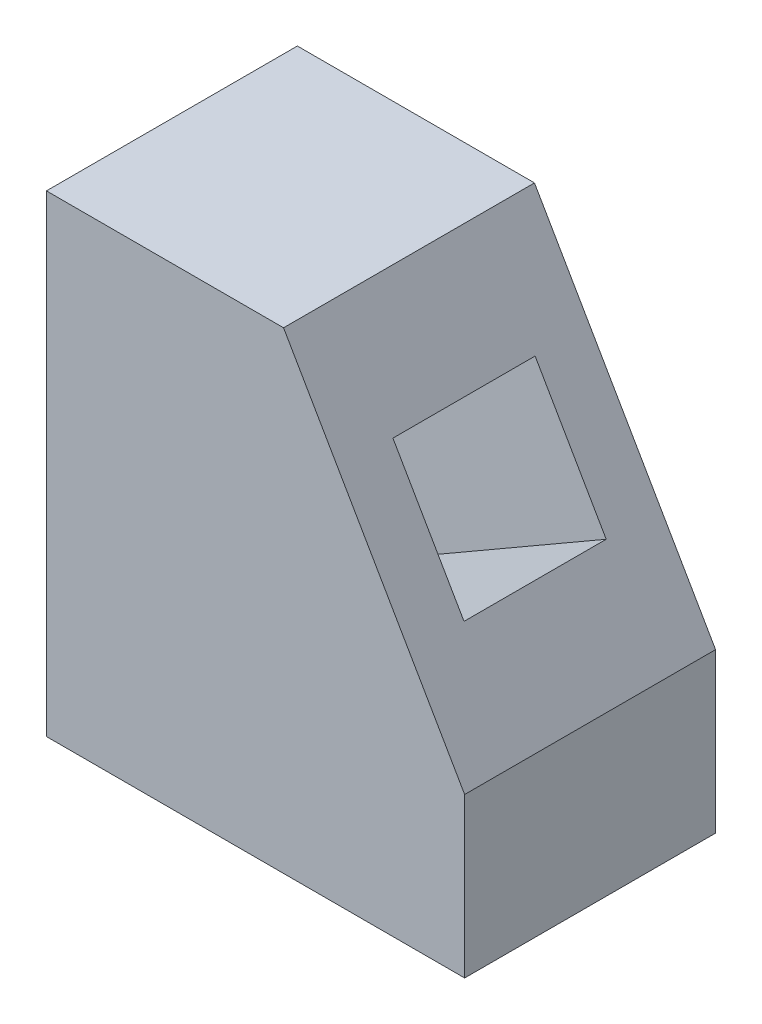
from build123d import *

# Parameters (mm, degrees)
SKETCH_1_W          = 10
SKETCH_1_H          = 6
EXTRUDE_1_DEPTH     = 11.3
CUT_EXTRUDE_1_REACH = 18.239
SKETCH_3_W          = 3.4
SKETCH_3_H          = 3.4
CUT_EXTRUDE_2_DEPTH = 8
SKETCH_4_R          = 0.5
CUT_EXTRUDE_3_DEPTH = 0.1


with BuildPart() as part:
    # 草图1 → 凸台-拉伸1 (new body)
    with BuildSketch(Plane(origin=(0, 0, 0), x_dir=(1, 0, 0), z_dir=(0, 1, 0))):
        with Locations((5, 3)):
            Rectangle(SKETCH_1_W, SKETCH_1_H)
    extrude(amount=EXTRUDE_1_DEPTH)

    # 草图2 → 切除-拉伸1 (cut, up to next)
    with BuildSketch(Plane(origin=(0, 0, -6), x_dir=(-1, 0, 0), z_dir=(0, 0, -1)), mode=Mode.PRIVATE) as cut_extrude_1_sk1:
        Polygon((-10, 3.8), (-5.669872981, 11.3), (-10, 11.3), align=None)
    cut_extrude_1_tool1 = extrude(cut_extrude_1_sk1.sketch, amount=-CUT_EXTRUDE_1_REACH, mode=Mode.PRIVATE) & part.part
    add(cut_extrude_1_tool1.solids().sort_by_distance((8.556624, 8.8, -6))[0], mode=Mode.SUBTRACT)

    # 草图3 → 切除-拉伸2 (cut)
    with BuildSketch(Plane(origin=(9.145448267, 5.280127019, 0), x_dir=(0, 0, -1), z_dir=(0.8660254037844417, 0.4999999999999948, 0))):
        with Locations((3, 2.621023553)):
            Rectangle(SKETCH_3_W, SKETCH_3_H)
    extrude(amount=-CUT_EXTRUDE_2_DEPTH, mode=Mode.SUBTRACT)

    # 草图4 → 切除-拉伸3 (cut)
    with BuildSketch(Plane.XZ):
        with Locations(Location((5, -3, 0), (0, 0, 270))):
            Circle(SKETCH_4_R)
    extrude(amount=-CUT_EXTRUDE_3_DEPTH, mode=Mode.SUBTRACT)


solid = part.part
